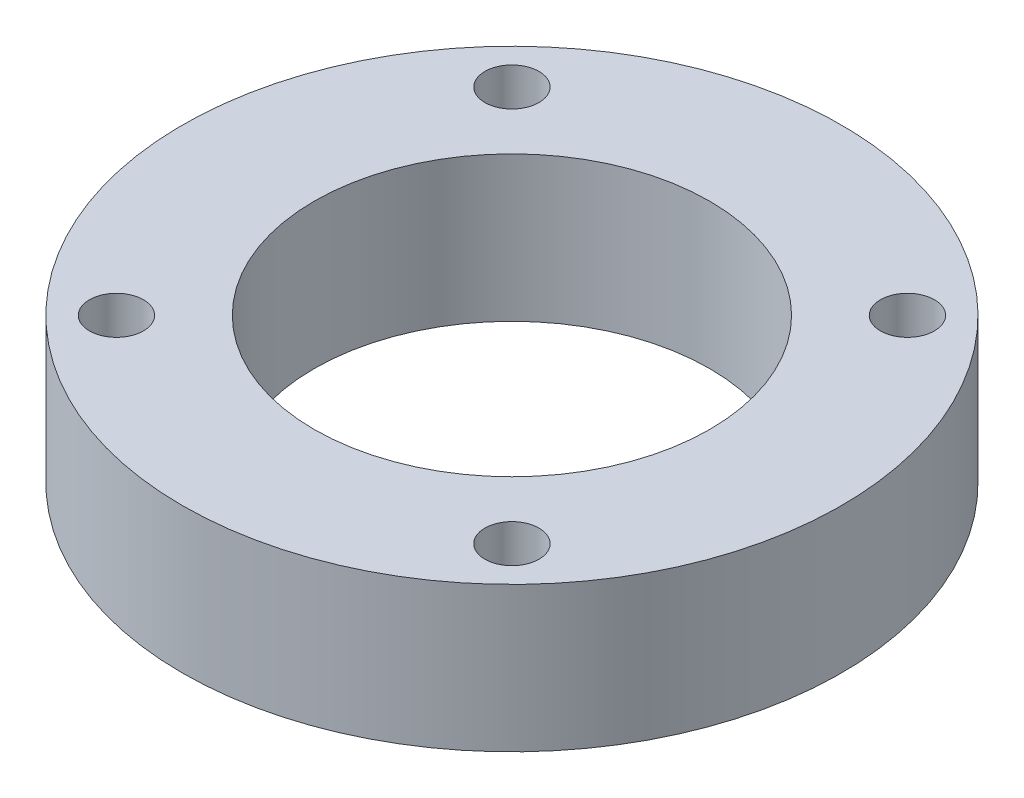
from build123d import *

# Parameters (mm, degrees)
SKETCH_1_R          = 25
SKETCH_1_R_2        = 2.05
EXTRUDE_1_DEPTH     = 11
SKETCH_2_R          = 15
CUT_EXTRUDE_1_DEPTH = 38.027017163


with BuildPart() as part:
    # 草图1 → 凸台-拉伸1 (new body)
    with BuildSketch(Plane(origin=(0, 0, 0), x_dir=(1, 0, 0), z_dir=(0, 1, 0))):
        with Locations(Location((0, 0, 0), (0, 0, 270))):
            Circle(SKETCH_1_R)
        with Locations(Location((-15, 15, 0), (0, 0, 270))):
            Circle(SKETCH_1_R_2, mode=Mode.SUBTRACT)
        with Locations(Location((15, 15, 0), (0, 0, 270))):
            Circle(SKETCH_1_R_2, mode=Mode.SUBTRACT)
        with Locations(Location((15, -15, 0), (0, 0, 270))):
            Circle(SKETCH_1_R_2, mode=Mode.SUBTRACT)
        with Locations(Location((-15, -15, 0), (0, 0, 270))):
            Circle(SKETCH_1_R_2, mode=Mode.SUBTRACT)
    extrude(amount=EXTRUDE_1_DEPTH)

    # 草图2 → 切除-拉伸1 (cut, through all)
    with BuildSketch(Plane(origin=(0, 11, 0), x_dir=(1, 0, 0), z_dir=(0, 1, 0))):
        with Locations(Location((0, 0, 0), (0, 0, 270))):
            Circle(SKETCH_2_R)
    extrude(amount=-CUT_EXTRUDE_1_DEPTH, mode=Mode.SUBTRACT)


solid = part.part
